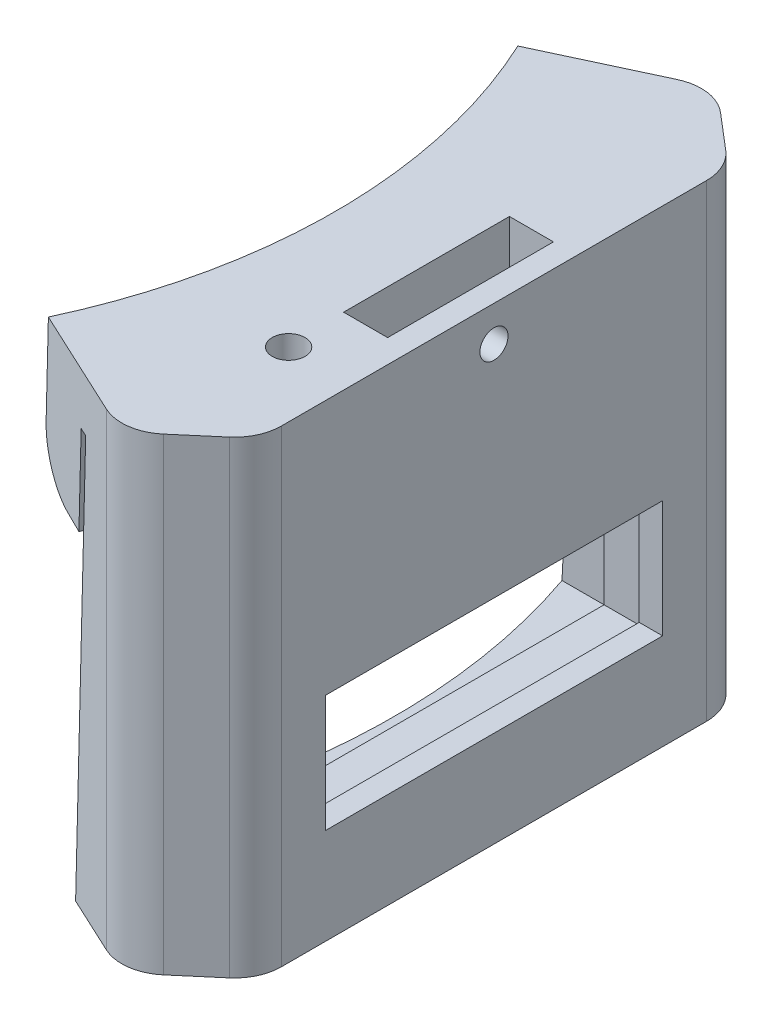
from build123d import *

# Parameters (mm, degrees)
REVOLU_O2_ANGLE          = 50
RESSALTO_EXTRUS_O1_START = -100
RESSALTO_EXTRUS_O1_DEPTH = 100
ESBO_O9_W                = 82
ESBO_O9_H                = 36
CORTE_EXTRUS_O6_DEPTH    = 147.5
ESBO_O11_W               = 72
ESBO_O11_H               = 25
CORTE_EXTRUS_O7_DEPTH    = 172
ESBO_O15_R               = 3.5
CORTE_EXTRUS_O8_DEPTH    = 49
ESBO_O16_W               = 86
ESBO_O16_H               = 40
ESBO_O16_W_2             = 82
ESBO_O16_H_2             = 36
CORTE_EXTRUS_O9_DEPTH    = 135
ESBO_O17_W               = 9.4
ESBO_O17_H               = 35.4
CORTE_EXTRUS_O10_DEPTH   = 30
ESBO_O18_R               = 3
CORTE_EXTRUS_O12_DEPTH   = 5
FILETE1_R                = 10


with BuildPart() as part:
    # Esboço1 → Revolução2 (revolve, symmetric)
    with BuildSketch(Plane.XY) as revolu_o2_sk:
        Polygon((133.047501561, 1), (132.06191984, -18.71163442), (117.080634756, -17.962570166), (118.578763265, 12), (150.6, 12), (150.6, -88), (130.6, -88), (135.05, 1), align=None)
    revolve(axis=Axis((0, -200, 0), (0, 1, 0)), revolution_arc=REVOLU_O2_ANGLE / 2)
    revolve(revolu_o2_sk.sketch, axis=Axis((0, -200, 0), (0, -1, 0)), revolution_arc=REVOLU_O2_ANGLE / 2)

    # Esboço10 → Ressalto-extrusão1 (add)
    with BuildSketch(Plane(origin=(0, 12, 0), x_dir=(1, 0, 0), z_dir=(0, 1, 0)).offset(RESSALTO_EXTRUS_O1_START)):
        with BuildLine():
            Line((152.489952728, 0), (150.6, 0))
            ThreePointArc((150.6, 0), (147.030178672, -32.595805859), (136.489952728, -63.646310218))
            Line((136.489952728, -63.646310218), (152.489952728, -50))
            Line((152.489952728, -50), (152.489952728, 0))
        make_face()
        with BuildLine():
            Line((152.489952728, 50), (136.489952728, 63.646310218))
            ThreePointArc((136.489952728, 63.646310218), (147.030178672, 32.595805859), (150.6, 0))
            Line((150.6, 0), (152.489952728, 0))
            Line((152.489952728, 0), (152.489952728, 50))
        make_face()
    extrude(amount=RESSALTO_EXTRUS_O1_DEPTH)

    # Esboço9 → Corte-extrusão6 (cut)
    with BuildSketch(Plane(origin=(0, 0, 0), x_dir=(0, 0, -1), z_dir=(1, 0, 0))):
        with Locations((0, -55)):
            Rectangle(ESBO_O9_W, ESBO_O9_H)
    extrude(amount=CORTE_EXTRUS_O6_DEPTH, mode=Mode.SUBTRACT)

    # Esboço11 → Corte-extrusão7 (cut)
    with BuildSketch(Plane(origin=(0, 0, 0), x_dir=(0, 0, -1), z_dir=(1, 0, 0))):
        with Locations((0, -55)):
            Rectangle(ESBO_O11_W, ESBO_O11_H)
    extrude(amount=CORTE_EXTRUS_O7_DEPTH, mode=Mode.SUBTRACT)

    # Esboço15 → Corte-extrusão8 (cut)
    with BuildSketch(Plane(origin=(0, 12, 0), x_dir=(1, 0, 0), z_dir=(0, 1, 0))):
        with Locations(Location((138.649952728, -30, 0), (0, 0, 270))):
            Circle(ESBO_O15_R)
    extrude(amount=-CORTE_EXTRUS_O8_DEPTH, mode=Mode.SUBTRACT)

    # Esboço16 → Corte-extrusão9 (cut)
    with BuildSketch(Plane(origin=(0, 0, 0), x_dir=(0, 0, -1), z_dir=(1, 0, 0))):
        with Locations((0, -55)):
            Rectangle(ESBO_O16_W, ESBO_O16_H)
        with Locations((0, -55)):
            Rectangle(ESBO_O16_W_2, ESBO_O16_H_2, mode=Mode.SUBTRACT)
    extrude(amount=CORTE_EXTRUS_O9_DEPTH, mode=Mode.SUBTRACT)

    # Esboço17 → Corte-extrusão10 (cut)
    with BuildSketch(Plane(origin=(0, 12, 0), x_dir=(1, 0, 0), z_dir=(0, 1, 0))):
        with Locations((142.789952728, 0)):
            Rectangle(ESBO_O17_W, ESBO_O17_H)
    extrude(amount=-CORTE_EXTRUS_O10_DEPTH, mode=Mode.SUBTRACT)

    # Esboço18 → Corte-extrusão12 (cut)
    with BuildSketch(Plane(origin=(152.489952728, 0, 0), x_dir=(0, 0, -1), z_dir=(1, 0, 0))):
        with Locations((0, 4.465209406)):
            Circle(ESBO_O18_R)
    extrude(amount=-CORTE_EXTRUS_O12_DEPTH, mode=Mode.SUBTRACT)

    # Filete1
    filete1_edges = [part.edges().sort_by_distance(p)[0] for p in [
        (117.080634756, -17.962570166, 0),
        (152.489952728, -38, -50),
        (152.489952728, -38, 50),
        (136.489952728, -38, -63.646310218),
        (136.489952728, -38, 63.646310218),
    ]]
    fillet(filete1_edges, radius=FILETE1_R)


solid = part.part
